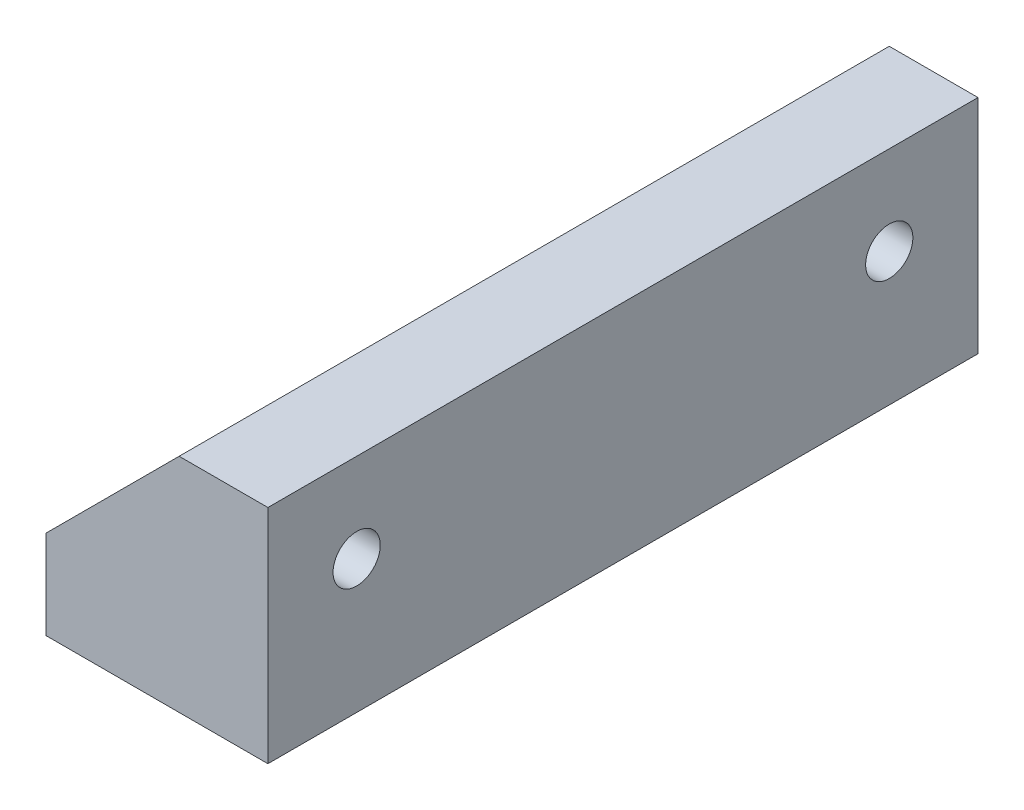
from build123d import *

# Parameters (mm, degrees)
SKETCH1_W                                        = 31.75
SKETCH1_H                                        = 101.6
BOSS_EXTRUDE1_DEPTH                              = 15.875
CUT_EXTRUDE1_REACH                               = 106.051
F_1_4_20_TAPPED_HOLE1_D                          = 5.1054
F_1_4_20_TAPPED_HOLE1_DEPTH                      = 12.7
F_1_4_20_TAPPED_HOLE1_TIP                        = 1.533816902
CBORE_FOR_1_4_SOCKET_HEAD_CAP_SCREW1_D           = 6.7564
CBORE_FOR_1_4_SOCKET_HEAD_CAP_SCREW1_CBORE_D     = 11.1125
CBORE_FOR_1_4_SOCKET_HEAD_CAP_SCREW1_CBORE_DEPTH = 20.32


with BuildPart() as part:
    # Sketch1 → Boss-Extrude1 (new, symmetric)
    with BuildSketch(Plane(origin=(0, 0, 0), x_dir=(1, 0, 0), z_dir=(0, 1, 0))):
        Rectangle(SKETCH1_W, SKETCH1_H)
    extrude(amount=BOSS_EXTRUDE1_DEPTH, both=True)

    # Sketch2 → Cut-Extrude1 (cut, up to next)
    with BuildSketch(Plane.XY.offset(50.8), mode=Mode.PRIVATE) as cut_extrude1_sk1:
        Polygon((-15.875, -3.175), (-15.875, 15.875), (3.175, 15.875), align=None)
    cut_extrude1_tool1 = extrude(cut_extrude1_sk1.sketch, amount=-CUT_EXTRUDE1_REACH, mode=Mode.PRIVATE) & part.part
    add(cut_extrude1_tool1.solids().sort_by_distance((-9.525, 9.525, 50.8))[0], mode=Mode.SUBTRACT)

    # 1/4-20 Tapped Hole1
    with Locations(Plane(origin=(-6.35, 6.35, 0), x_dir=(0, 0, 1), z_dir=(-0.7071067811865513, 0.7071067811865438, 0))):
        with Locations((-25.4, 0), (25.4, 0)):
            Hole(F_1_4_20_TAPPED_HOLE1_D / 2, depth=F_1_4_20_TAPPED_HOLE1_DEPTH)
            with Locations((0, 0, -(F_1_4_20_TAPPED_HOLE1_DEPTH + F_1_4_20_TAPPED_HOLE1_TIP / 2))):  # 118° drill point
                Cone(0, F_1_4_20_TAPPED_HOLE1_D / 2, F_1_4_20_TAPPED_HOLE1_TIP, mode=Mode.SUBTRACT)

    # CBORE for 1/4 Socket Head Cap Screw1 (through all)
    with Locations(Plane.ZY.offset(15.875)):
        with Locations((-38.1, 3.175), (38.1, 3.175)):
            CounterBoreHole(CBORE_FOR_1_4_SOCKET_HEAD_CAP_SCREW1_D / 2, CBORE_FOR_1_4_SOCKET_HEAD_CAP_SCREW1_CBORE_D / 2, CBORE_FOR_1_4_SOCKET_HEAD_CAP_SCREW1_CBORE_DEPTH)


solid = part.part
